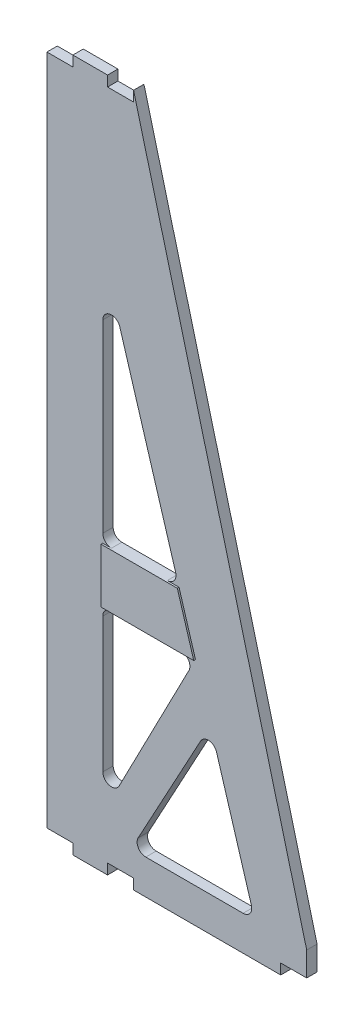
from build123d import *

# Parameters (mm, degrees)
RESSALTO_EXTRUS_O1_DEPTH = 6
CORTE_EXTRUS_O1_DEPTH    = 428.242320001
FILETE1_R                = 5
RESSALTO_EXTRUS_O3_DEPTH = 7
RESSALTO_EXTRUS_O4_DEPTH = 6
FILETE2_R                = 5
ESBO_O13_W               = 15
ESBO_O13_H               = 6
CORTE_EXTRUS_O2_DEPTH    = 428.242320001
ESBO_O15_W               = 15
ESBO_O15_H               = 6
CORTE_EXTRUS_O3_DEPTH    = 428.242320001


with BuildPart() as part:
    # Esboço2 → Ressalto-extrusão1 (new body)
    with BuildSketch(Plane.XY):
        Polygon((0, 0), (0, 400), (50, 400), (150, 20), (150, 0), align=None)
    extrude(amount=RESSALTO_EXTRUS_O1_DEPTH)

    # Esboço7 → Corte-extrusão1 (cut, through all)
    with BuildSketch(Plane(origin=(0, 0, 0), x_dir=(-1, 0, 0), z_dir=(0, 0, -1))):
        Polygon((-32.276413741, 20), (-32.276413741, 310), (-120, 20), align=None)
    extrude(amount=-CORTE_EXTRUS_O1_DEPTH, mode=Mode.SUBTRACT)

    # Filete1
    filete1_edges = [part.edges().sort_by_distance(p)[0] for p in [
        (32.276413741, 20, 3),
        (120, 20, 3),
        (32.276413741, 310, 3),
    ]]
    fillet(filete1_edges, radius=FILETE1_R)

    # Esboço11 → Ressalto-extrusão3 (add)
    with BuildSketch(Plane(origin=(0, 0, 0), x_dir=(-1, 0, 0), z_dir=(0, 0, -1))):
        Polygon((-85.790275479, 133.09182096), (-32.276413741, 133.09182096), (-32.276413741, 164.53133753), (-76.279974983, 164.53133753), align=None)
    extrude(amount=-RESSALTO_EXTRUS_O3_DEPTH)

    # Esboço12 → Ressalto-extrusão4 (add)
    with BuildSketch(Plane(origin=(0, 0, 0), x_dir=(-1, 0, 0), z_dir=(0, 0, -1))):
        Polygon((-85.790275479, 133.09182096), (-32.276413741, 29.65724659), (-27.594715127, 20), (-48.670406936, 20), (-94.468741252, 104.402215557), align=None)
    extrude(amount=-RESSALTO_EXTRUS_O4_DEPTH)

    # Filete2
    filete2_edges = [part.edges().sort_by_distance(p)[0] for p in [
        (32.276413741, 133.09182096, 3),
        (32.276413741, 164.53133753, 3),
        (85.790275479, 133.09182096, 3),
        (76.279974983, 164.53133753, 3),
        (94.468741252, 104.402215557, 3),
        (32.276413741, 29.65724659, 3),
        (48.670406936, 20, 3),
    ]]
    fillet(filete2_edges, radius=FILETE2_R)

    # Esboço13 → Corte-extrusão2 (cut, through all)
    with BuildSketch(Plane.XY.offset(6)):
        with Locations((7.5, 397)):
            Rectangle(ESBO_O13_W, ESBO_O13_H)
        with Locations((42.525660804, 397)):
            Rectangle(ESBO_O13_W, ESBO_O13_H)
    extrude(amount=-CORTE_EXTRUS_O2_DEPTH, mode=Mode.SUBTRACT)

    # Esboço15 → Corte-extrusão3 (cut, through all)
    with BuildSketch(Plane.XY.offset(6)):
        with Locations((7.5, 3)):
            Rectangle(ESBO_O15_W, ESBO_O15_H)
        with Locations((42.5, 3)):
            Rectangle(ESBO_O15_W, ESBO_O15_H)
        with Locations((142.5, 3)):
            Rectangle(ESBO_O15_W, ESBO_O15_H)
    extrude(amount=-CORTE_EXTRUS_O3_DEPTH, mode=Mode.SUBTRACT)


solid = part.part
